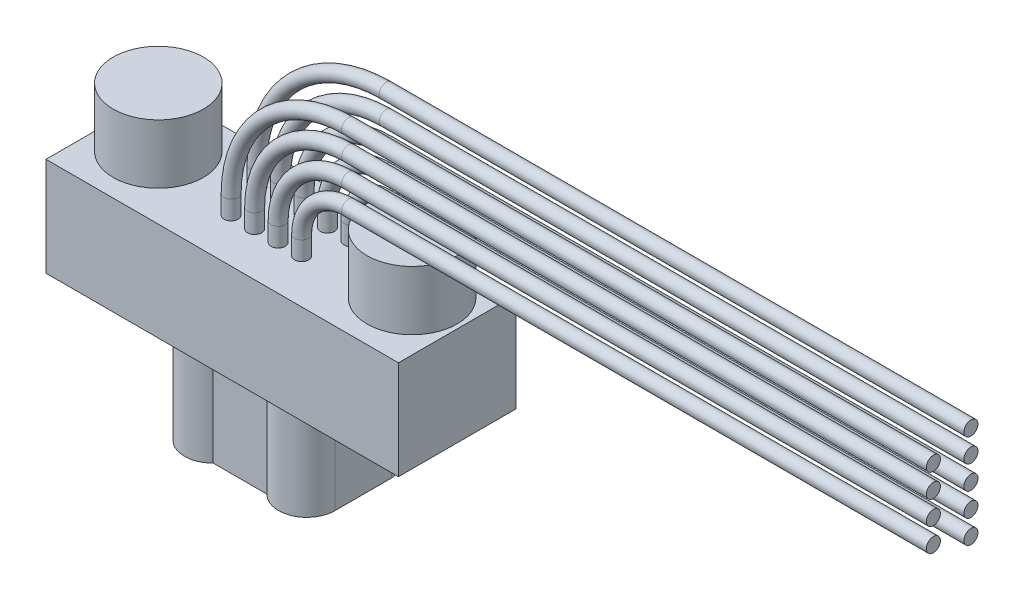
from build123d import *

# Parameters (mm, degrees)
SKETCH2_W           = 9.525
SKETCH2_H           = 3.175
BOSS_EXTRUDE2_DEPTH = 2.667
BOSS_EXTRUDE3_DEPTH = 2.667
SKETCH4_R           = 0.1905
SKETCH8_R           = 1.2192
BOSS_EXTRUDE4_DEPTH = 1.6002


with BuildPart() as part:
    # Sketch2 → Boss-Extrude2 (new body)
    with BuildSketch(Plane(origin=(0, 0, 0), x_dir=(1, 0, 0), z_dir=(0, 1, 0))):
        with Locations((0, -0.1143)):
            Rectangle(SKETCH2_W, SKETCH2_H)
    extrude(amount=BOSS_EXTRUDE2_DEPTH)

    # Sketch7 → Boss-Extrude3 (add)
    with BuildSketch(Plane(origin=(0, 0, 0), x_dir=(1, 0, 0), z_dir=(0, 1, 0))):
        with BuildLine():
            Line((-1.651, 1.2192), (1.651, 1.2192))
            ThreePointArc((1.651, 1.2192), (1.920407684, 1.107607684), (2.032, 0.8382))
            Line((2.032, 0.8382), (2.032, -0.6858))
            ThreePointArc((2.032, -0.6858), (1.558080929, -1.391245518), (0.725823154, -1.2192))
            Line((0.725823154, -1.2192), (-0.725823154, -1.2192))
            ThreePointArc((-0.725823154, -1.2192), (-1.558080929, -1.391245518), (-2.032, -0.6858))
            Line((-2.032, -0.6858), (-2.032, 0.8382))
            ThreePointArc((-2.032, 0.8382), (-1.920407684, 1.107607684), (-1.651, 1.2192))
        make_face()
    extrude(amount=-BOSS_EXTRUDE3_DEPTH)

    # Sweep1: sweep along a path in Sketch3
    with BuildLine(Plane.XY) as sweep1_path:
        Line((0.9525, 0), (0.9525, 3.175))
        ThreePointArc((0.9525, 3.175), (1.324474388, 4.073025612), (2.2225, 4.445))
        Line((2.2225, 4.445), (18.025121384, 4.445))
    # Sketch4 → Sweep1 (sweep)
    with BuildSketch(Plane(origin=(0, 0, 0), x_dir=(1, 0, 0), z_dir=(0, 1, 0))):
        with Locations((0.9525, -0.508)):
            Circle(SKETCH4_R)
        with Locations((0.3175, -0.508)):
            Circle(SKETCH4_R)
        with Locations((-0.3175, -0.508)):
            Circle(SKETCH4_R)
        with Locations((-0.9525, -0.508)):
            Circle(SKETCH4_R)
        with Locations((1.27, 0.508)):
            Circle(SKETCH4_R)
        with Locations((0.635, 0.508)):
            Circle(SKETCH4_R)
        with Locations((0, 0.508)):
            Circle(SKETCH4_R)
        with Locations((-0.635, 0.508)):
            Circle(SKETCH4_R)
        with Locations((-1.27, 0.508)):
            Circle(SKETCH4_R)
    sweep(path=sweep1_path.line)

    # Sketch8 → Boss-Extrude4 (add)
    with BuildSketch(Plane(origin=(0, 2.667, 0), x_dir=(1, 0, 0), z_dir=(0, 1, 0))):
        with Locations(Location((3.429, 0, 0), (0, 0, 148.473273174))):
            Circle(SKETCH8_R)
        with Locations(Location((-3.429, 0, 0), (0, 0, 270))):
            Circle(SKETCH8_R)
    extrude(amount=BOSS_EXTRUDE4_DEPTH)


solid = part.part
